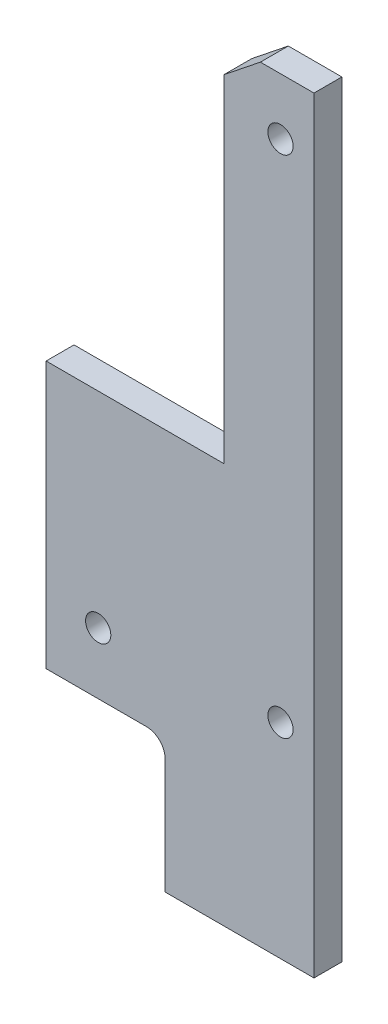
from build123d import *

# Parameters (mm, degrees)
BOSS_EXTRUDE1_DEPTH = 4.7625
SKETCH3_R           = 2.15265
CUT_EXTRUDE1_DEPTH  = 139.651562942


with BuildPart() as part:
    # Sketch1 → Boss-Extrude1 (new body)
    with BuildSketch(Plane.XY):
        with BuildLine():
            Line((-15.392138512, 125.820167161), (-15.392138512, 68.343175012))
            Line((-15.392138512, 68.343175012), (-45.72, 68.343175012))
            Line((-45.72, 68.343175012), (-45.72, 22.86))
            Line((-45.72, 22.86), (-28.575, 22.86))
            ThreePointArc((-28.575, 22.86), (-26.32993597, 21.93006403), (-25.4, 19.685))
            Line((-25.4, 19.685), (-25.4, 0))
            Line((-25.4, 0), (0, 0))
            Line((0, 0), (0, 130.81))
            Line((0, 130.81), (-9.144, 130.81))
            Line((-9.144, 130.81), (-15.392138512, 125.820167161))
        make_face()
    extrude(amount=BOSS_EXTRUDE1_DEPTH)

    # Sketch3 → Cut-Extrude1 (cut, through all)
    with BuildSketch(Plane(origin=(0, 0, 0), x_dir=(-1, 0, 0), z_dir=(0, 0, -1))):
        with Locations((5.715, 121.158)):
            Circle(SKETCH3_R)
        with Locations((5.715, 34.925)):
            Circle(SKETCH3_R)
        with Locations((36.83, 33.3375)):
            Circle(SKETCH3_R)
    extrude(amount=-CUT_EXTRUDE1_DEPTH, mode=Mode.SUBTRACT)


solid = part.part
